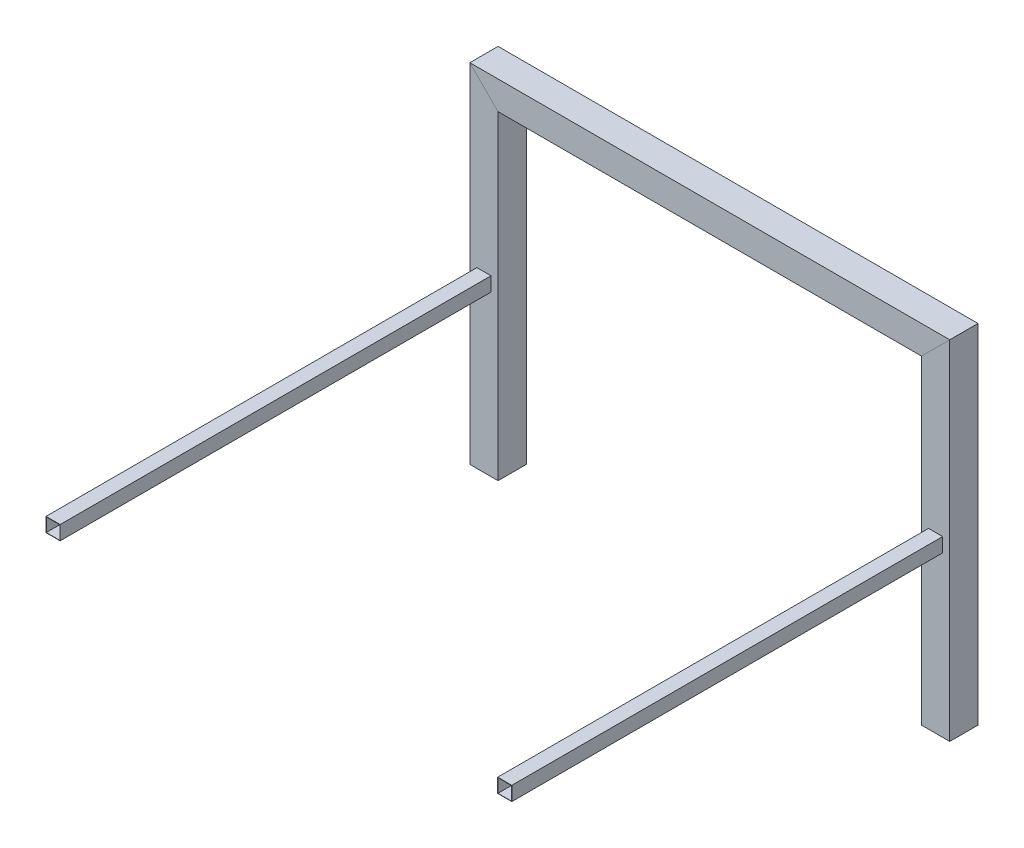
from build123d import *

# Parameters (mm, degrees)
SKETCH11_W                               = 50.8
SKETCH11_H                               = 50.8
SKETCH11_W_2                             = 48.3108
SKETCH11_H_2                             = 48.3108
AL_TUBE_SQUARE_2_SQ_X_049_WALL_3_DEPTH   = 636.921024484
SKETCH11_ON_SEGMENT_2_W                  = 50.8
SKETCH11_ON_SEGMENT_2_H                  = 50.8
SKETCH11_ON_SEGMENT_2_W_2                = 48.3108
SKETCH11_ON_SEGMENT_2_H_2                = 48.3108
AL_TUBE_SQUARE_2_SQ_X_049_WALL_3_2_DEPTH = 885.842048969
SKETCH11_ON_SEGMENT_3_W                  = 50.8
SKETCH11_ON_SEGMENT_3_H                  = 50.8
SKETCH11_ON_SEGMENT_3_W_2                = 48.3108
SKETCH11_ON_SEGMENT_3_H_2                = 48.3108
AL_TUBE_SQUARE_2_SQ_X_049_WALL_3_4_DEPTH = 636.921024484
SKETCH1_W                                = 25.4
SKETCH1_H                                = 25.4
SKETCH1_W_2                              = 24.2824
SKETCH1_H_2                              = 24.2824
AL_TUBE_SQUARE_1_SQ_X_022_WALL_7_DEPTH   = 800
SKETCH1_ON_SEGMENT_2_W                   = 25.4
SKETCH1_ON_SEGMENT_2_H                   = 25.4
SKETCH1_ON_SEGMENT_2_W_2                 = 24.2824
SKETCH1_ON_SEGMENT_2_H_2                 = 24.2824
AL_TUBE_SQUARE_1_SQ_X_022_WALL_7_2_DEPTH = 800


with BuildPart() as part:
    # Sketch11 → Al tube (square) 2 SQ X .049 WALL(3) (new body)
    with BuildSketch(Plane(origin=(0, 0, 0), x_dir=(1, 0, 0), z_dir=(0, 1, 0))):
        Rectangle(SKETCH11_W, SKETCH11_H)
        Rectangle(SKETCH11_W_2, SKETCH11_H_2, mode=Mode.SUBTRACT)
    extrude(amount=AL_TUBE_SQUARE_2_SQ_X_049_WALL_3_DEPTH)

    # Al tube (square) 2 SQ X .049 WALL(3) mitr
    split(bisect_by=Plane(origin=(0, 600, 0), x_dir=(0.707106781, -0.707106781, 0), z_dir=(-0.707106781, -0.707106781, 0)), keep=Keep.TOP)


with BuildPart() as body_2:
    # Sketch11 on segment 2 (carried to segment 2) → Al tube _square_ 2 SQ X .049 WALL_3 2 (new body)
    with BuildSketch(Plane(origin=(-36.921024484, 600, 0), x_dir=(0, -1, 0), z_dir=(1, 0, 0))):
        Rectangle(SKETCH11_ON_SEGMENT_2_W, SKETCH11_ON_SEGMENT_2_H)
        Rectangle(SKETCH11_ON_SEGMENT_2_W_2, SKETCH11_ON_SEGMENT_2_H_2, mode=Mode.SUBTRACT)
    extrude(amount=AL_TUBE_SQUARE_2_SQ_X_049_WALL_3_2_DEPTH)

    # Al tube _square_ 2 SQ X .049 WALL_3 2 mi
    split(bisect_by=Plane(origin=(0, 600, 0), x_dir=(-0.707106781, 0.707106781, 0), z_dir=(0.707106781, 0.707106781, 0)), keep=Keep.TOP)

    # Al tube (square) 2 SQ X .049 WALL(3)  3
    split(bisect_by=Plane(origin=(812, 600, 0), x_dir=(-0.707106781, -0.707106781, 0), z_dir=(-0.707106781, 0.707106781, 0)), keep=Keep.TOP)


with BuildPart() as body_3:
    # Sketch11 on segment 3 (carried to segment 3) → Al tube (square) 2 SQ X .049 WALL(3)  4 (new body)
    with BuildSketch(Plane(origin=(812, 636.921024484, 0), x_dir=(-1, 0, 0), z_dir=(0, -1, 0))):
        Rectangle(SKETCH11_ON_SEGMENT_3_W, SKETCH11_ON_SEGMENT_3_H)
        Rectangle(SKETCH11_ON_SEGMENT_3_W_2, SKETCH11_ON_SEGMENT_3_H_2, mode=Mode.SUBTRACT)
    extrude(amount=AL_TUBE_SQUARE_2_SQ_X_049_WALL_3_4_DEPTH)

    # Al tube _square_ 2 SQ X .049 WALL_3 4 mi
    split(bisect_by=Plane(origin=(812, 600, 0), x_dir=(0.707106781, 0.707106781, 0), z_dir=(0.707106781, -0.707106781, 0)), keep=Keep.TOP)


with BuildPart() as body_4:
    # Sketch1 → Al tube (square) 1 SQ X .022 WALL(7) (new body)
    with BuildSketch(Plane(origin=(0, 300, 0), x_dir=(1, 0, 0), z_dir=(0, 0, 1))):
        Rectangle(SKETCH1_W, SKETCH1_H)
        Rectangle(SKETCH1_W_2, SKETCH1_H_2, mode=Mode.SUBTRACT)
    extrude(amount=AL_TUBE_SQUARE_1_SQ_X_022_WALL_7_DEPTH)

    # Recortar/Extender1
    split(bisect_by=Plane(origin=(812.358422222, 300.179211111, 25.4), x_dir=(0, -1, 0), z_dir=(0, 0, 1)), keep=Keep.TOP)


with BuildPart() as body_5:
    # Sketch1 on segment 2 (carried to segment 2) → Al tube _square_ 1 SQ X .022 WALL_7 2 (new body)
    with BuildSketch(Plane(origin=(812, 300, 0), x_dir=(1, 0, 0), z_dir=(0, 0, 1))):
        Rectangle(SKETCH1_ON_SEGMENT_2_W, SKETCH1_ON_SEGMENT_2_H)
        Rectangle(SKETCH1_ON_SEGMENT_2_W_2, SKETCH1_ON_SEGMENT_2_H_2, mode=Mode.SUBTRACT)
    extrude(amount=AL_TUBE_SQUARE_1_SQ_X_022_WALL_7_2_DEPTH)

    # Recortar/Extender1
    split(bisect_by=Plane(origin=(812.358422222, 300.179211111, 25.4), x_dir=(0, -1, 0), z_dir=(0, 0, 1)), keep=Keep.TOP)


solid = Compound([part.part, body_2.part, body_3.part, body_4.part, body_5.part])
